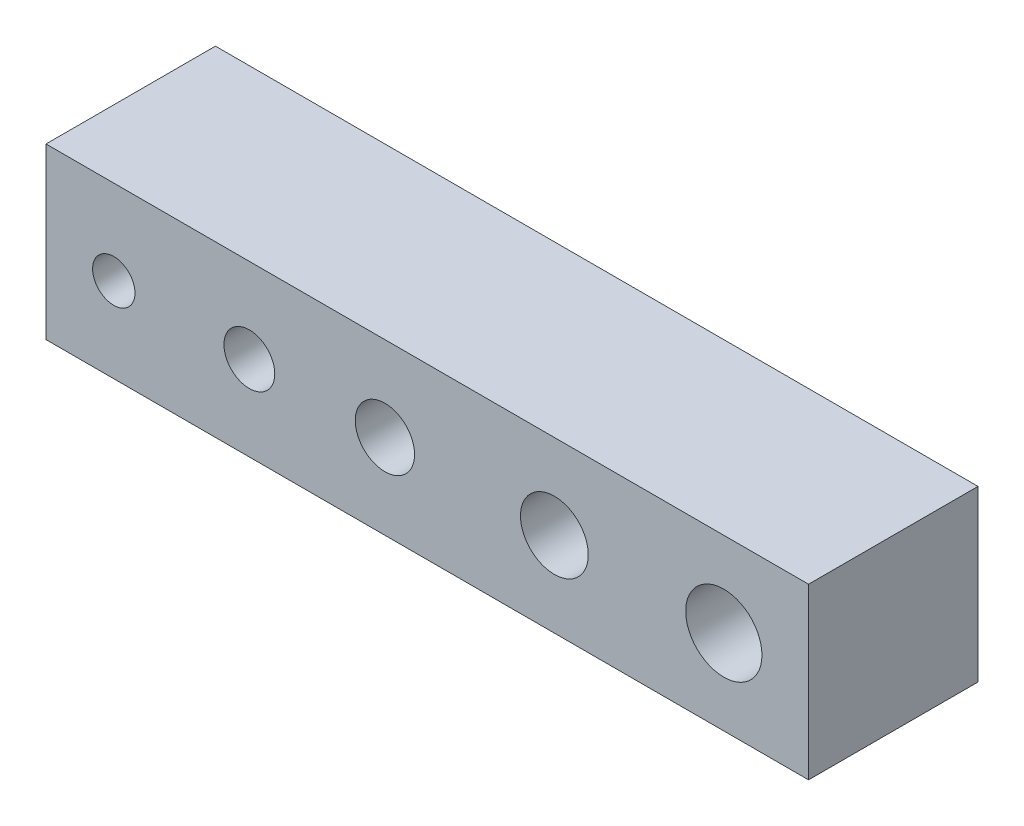
from build123d import *

# Parameters (mm, degrees)
SKETCH1_W           = 45
SKETCH1_H           = 10
BOSS_EXTRUDE1_DEPTH = 10
SKETCH2_R           = 1.25
SKETCH2_R_2         = 1.5
SKETCH2_R_3         = 1.75
SKETCH2_R_4         = 2
SKETCH2_R_5         = 2.25
CUT_EXTRUDE1_DEPTH  = 16


with BuildPart() as part:
    # Sketch1 → Boss-Extrude1 (new body)
    with BuildSketch(Plane.XY):
        with Locations((-22.5, -5)):
            Rectangle(SKETCH1_W, SKETCH1_H)
    extrude(amount=BOSS_EXTRUDE1_DEPTH)

    # Sketch2 → Cut-Extrude1 (cut)
    with BuildSketch(Plane.XY.offset(10)):
        with Locations((-41, -5)):
            Circle(SKETCH2_R)
        with Locations((-33, -5)):
            Circle(SKETCH2_R_2)
        with Locations((-25, -5)):
            Circle(SKETCH2_R_3)
        with Locations((-15, -5)):
            Circle(SKETCH2_R_4)
        with Locations((-5, -5)):
            Circle(SKETCH2_R_5)
    extrude(amount=-CUT_EXTRUDE1_DEPTH, mode=Mode.SUBTRACT)


solid = part.part
